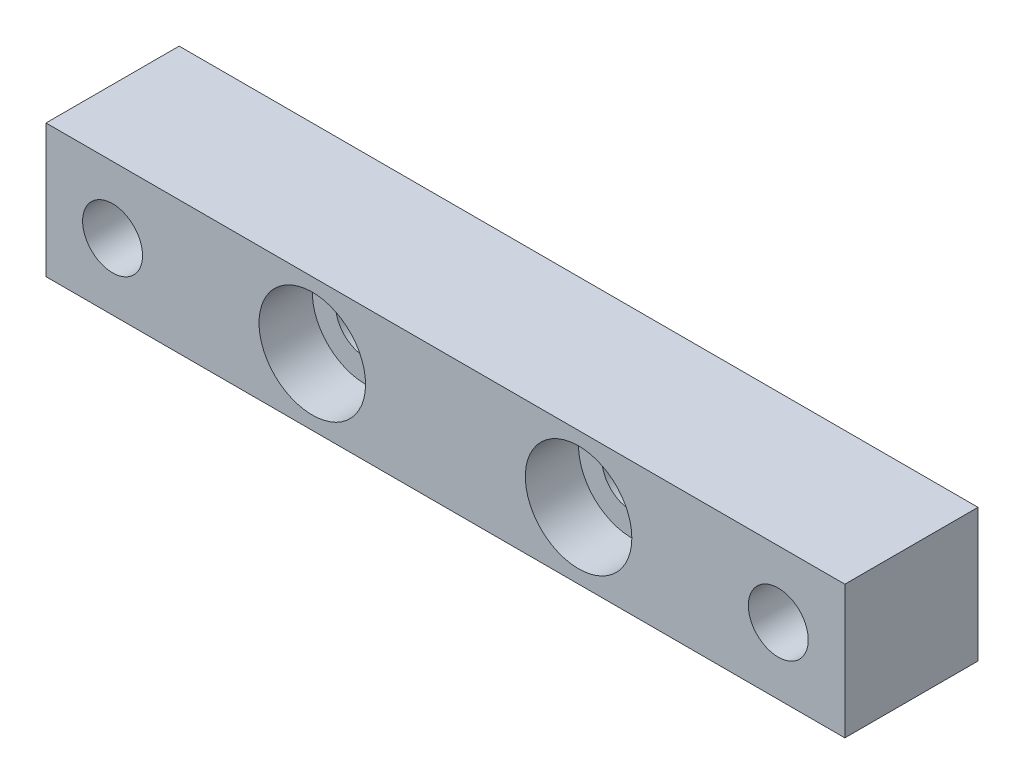
from build123d import *

# Parameters (mm, degrees)
CROQUIS1_W              = 60
CROQUIS1_H              = 10
CROQUIS1_R              = 2.25
SALIENTE_EXTRUIR1_DEPTH = 5
CROQUIS4_R              = 4
CORTAR_EXTRUIR1_DEPTH   = 4


with BuildPart() as part:
    # Croquis1 → Saliente-Extruir1 (new, symmetric)
    with BuildSketch(Plane.XY):
        Rectangle(CROQUIS1_W, CROQUIS1_H)
        with Locations((-10, 0)):
            Circle(CROQUIS1_R, mode=Mode.SUBTRACT)
        with Locations((10, 0)):
            Circle(CROQUIS1_R, mode=Mode.SUBTRACT)
        with Locations((-25, 0)):
            Circle(CROQUIS1_R, mode=Mode.SUBTRACT)
        with Locations(Location((25, 0, 0), (0, 0, 180))):
            Circle(CROQUIS1_R, mode=Mode.SUBTRACT)
    extrude(amount=SALIENTE_EXTRUIR1_DEPTH, both=True)

    # Croquis4 → Cortar-Extruir1 (cut)
    with BuildSketch(Plane.XY.offset(5)):
        with Locations((-10, 0)):
            Circle(CROQUIS4_R)
        with Locations((10, 0)):
            Circle(CROQUIS4_R)
    extrude(amount=-CORTAR_EXTRUIR1_DEPTH, mode=Mode.SUBTRACT)


solid = part.part
